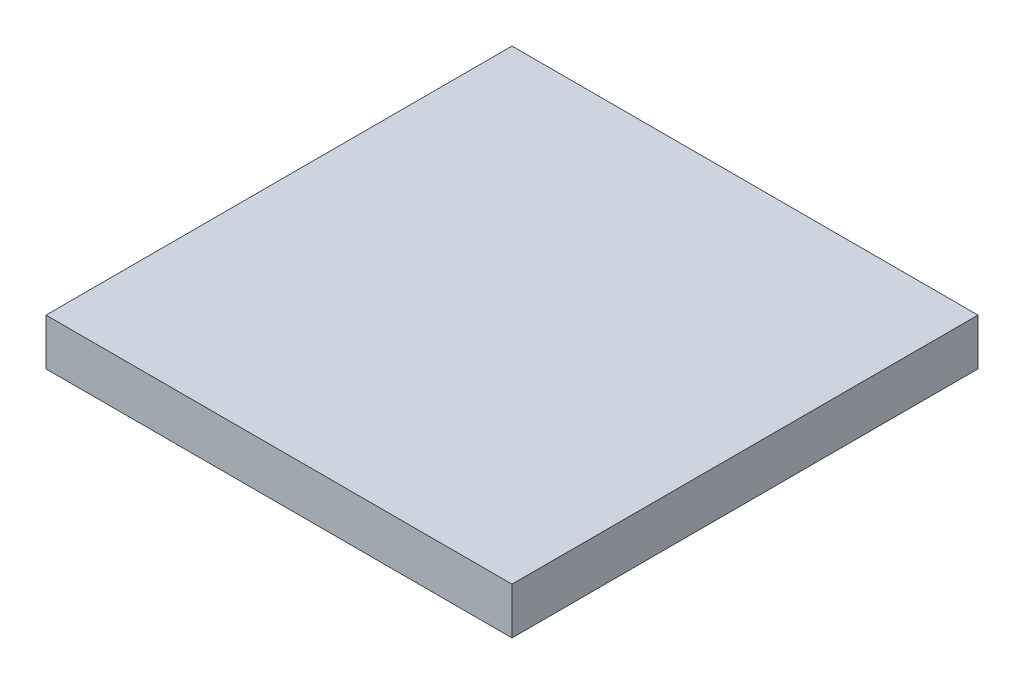
from build123d import *

# Parameters (mm, degrees)
SKETCH_2_W      = 100
SKETCH_2_H      = 100
EXTRUDE_2_DEPTH = 10


with BuildPart() as part:
    # 草图2 → 凸台-拉伸2 (new body)
    with BuildSketch(Plane(origin=(0, 0, 0), x_dir=(1, 0, 0), z_dir=(0, 1, 0))):
        Rectangle(SKETCH_2_W, SKETCH_2_H)
    extrude(amount=EXTRUDE_2_DEPTH)


solid = part.part
